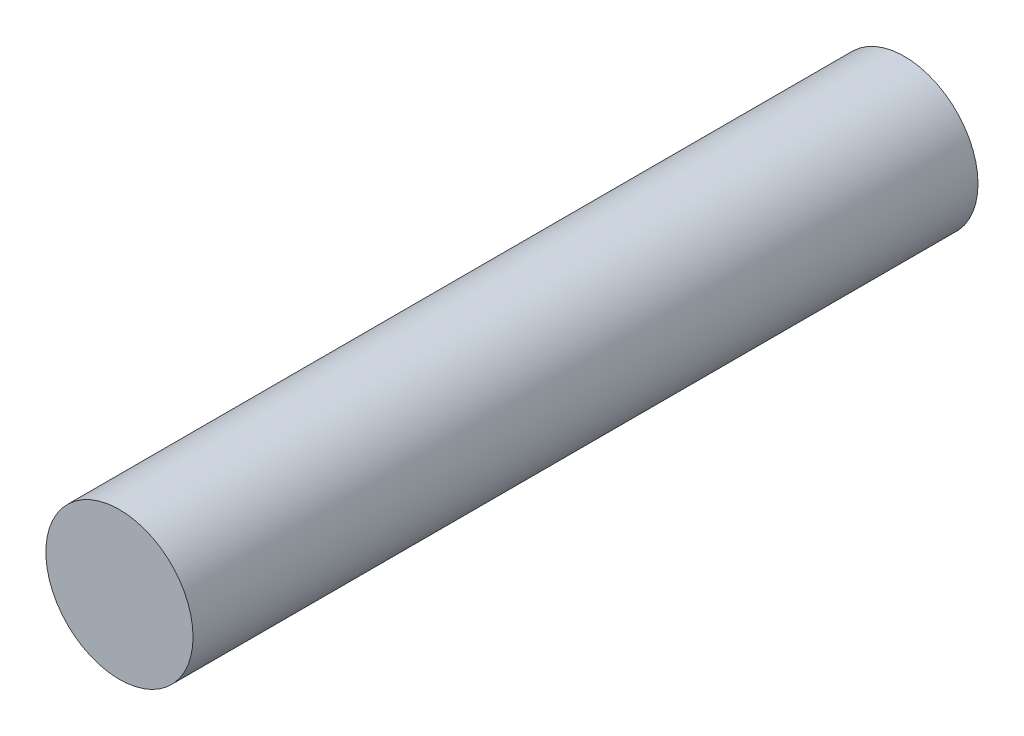
from build123d import *

# Parameters (mm, degrees)
SKETCH1_R           = 3
BOSS_EXTRUDE1_DEPTH = 32


with BuildPart() as part:
    # Sketch1 → Boss-Extrude1 (new body)
    with BuildSketch(Plane.XY):
        Circle(SKETCH1_R)
    extrude(amount=BOSS_EXTRUDE1_DEPTH)


solid = part.part
